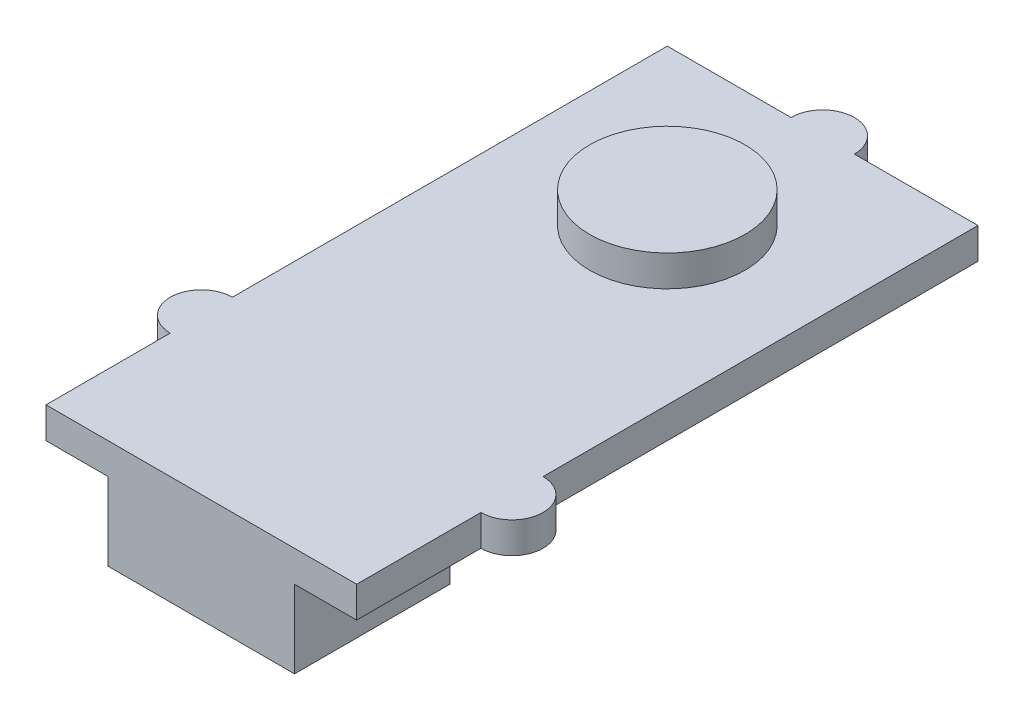
from build123d import *

# Parameters (mm, degrees)
BOSS_EXTRUDE1_DEPTH = 2
SKETCH3_R           = 5
BOSS_EXTRUDE2_DEPTH = 2
SKETCH5_W           = 12
SKETCH5_H           = 10
BOSS_EXTRUDE3_DEPTH = 5


with BuildPart() as part:
    # Sketch2 → Boss-Extrude1 (new body)
    with BuildSketch(Plane(origin=(0, 0, 0), x_dir=(1, 0, 0), z_dir=(0, 1, 0))):
        with BuildLine():
            Line((2.043336986, 20), (10, 20))
            Line((10, 20), (10, -8))
            ThreePointArc((10, -8), (12, -10), (10, -12))
            Line((10, -12), (10, -20))
            Line((10, -20), (-10, -20))
            Line((-10, -20), (-10, -12))
            ThreePointArc((-10, -12), (-12, -10), (-10, -8))
            Line((-10, -8), (-10, 20))
            Line((-10, 20), (-2.043336986, 20))
            ThreePointArc((-2.043336986, 20), (0, 22.043336986), (2.043336986, 20))
        make_face()
    extrude(amount=BOSS_EXTRUDE1_DEPTH)

    # Sketch3 → Boss-Extrude2 (add)
    with BuildSketch(Plane(origin=(0, 2, 0), x_dir=(1, 0, 0), z_dir=(0, 1, 0))):
        with Locations(Location((0, 10, 0), (0, 0, 270))):
            Circle(SKETCH3_R)
    extrude(amount=BOSS_EXTRUDE2_DEPTH)

    # Sketch5 → Boss-Extrude3 (add)
    with BuildSketch(Plane.XZ):
        with Locations((0, 15)):
            Rectangle(SKETCH5_W, SKETCH5_H)
    extrude(amount=BOSS_EXTRUDE3_DEPTH)


solid = part.part
